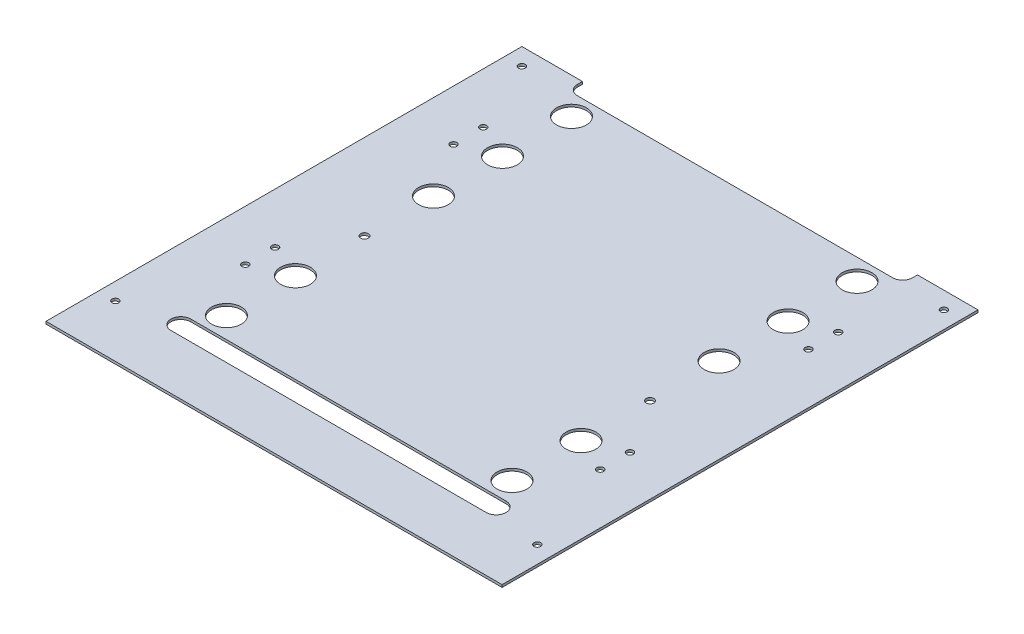
from build123d import *

# Parameters (mm, degrees)
SKETCH1_R           = 2.15265
SKETCH1_R_2         = 9.525
SKETCH1_R_3         = 2.4892
BOSS_EXTRUDE1_DEPTH = 1.5875


with BuildPart() as part:
    # Sketch1 → Boss-Extrude1 (new body)
    with BuildSketch(Plane(origin=(0, 0, 0), x_dir=(1, 0, 0), z_dir=(0, 1, 0))):
        with BuildLine():
            Line((-107.315, 152.4), (-146.05, 152.4))
            Line((-146.05, 152.4), (-146.05, -152.4))
            Line((-146.05, -152.4), (146.05, -152.4))
            Line((146.05, -152.4), (146.05, 152.4))
            Line((146.05, 152.4), (107.315, 152.4))
            Line((107.315, 152.4), (107.315, 149.225))
            ThreePointArc((107.315, 149.225), (105.455128061, 144.734871939), (100.965, 142.875))
            Line((100.965, 142.875), (-100.965, 142.875))
            ThreePointArc((-100.965, 142.875), (-105.455128061, 144.734871939), (-107.315, 149.225))
            Line((-107.315, 149.225), (-107.315, 152.4))
        make_face()
        with Locations(Location((-135.128, -118.872, 0), (0, 0, 270))):
            Circle(SKETCH1_R, mode=Mode.SUBTRACT)
        with Locations(Location((-91.44, -91.44, 0), (0, 0, 270))):
            Circle(SKETCH1_R_2, mode=Mode.SUBTRACT)
        with Locations(Location((-113.665, -57.15, 0), (0, 0, 270))):
            Circle(SKETCH1_R, mode=Mode.SUBTRACT)
        with Locations(Location((-113.665, -38.1, 0), (0, 0, 270))):
            Circle(SKETCH1_R, mode=Mode.SUBTRACT)
        with Locations(Location((-91.44, -47.244, 0), (0, 0, 270))):
            Circle(SKETCH1_R_2, mode=Mode.SUBTRACT)
        with Locations(Location((-91.44, -3.048, 0), (0, 0, 270))):
            Circle(SKETCH1_R_3, mode=Mode.SUBTRACT)
        with BuildLine():
            ThreePointArc((-100.965, -117.475), (-107.315, -111.125), (-100.965, -104.775))
            Line((-100.965, -104.775), (100.965, -104.775))
            ThreePointArc((100.965, -104.775), (107.315, -111.125), (100.965, -117.475))
            Line((100.965, -117.475), (-100.965, -117.475))
        make_face(mode=Mode.SUBTRACT)
        with Locations(Location((135.128, -118.872, 0), (0, 0, 270))):
            Circle(SKETCH1_R, mode=Mode.SUBTRACT)
        with Locations(Location((91.44, -91.44, 0), (0, 0, 270))):
            Circle(SKETCH1_R_2, mode=Mode.SUBTRACT)
        with Locations(Location((91.44, -47.244, 0), (0, 0, 270))):
            Circle(SKETCH1_R_2, mode=Mode.SUBTRACT)
        with Locations(Location((113.665, -57.15, 0), (0, 0, 270))):
            Circle(SKETCH1_R, mode=Mode.SUBTRACT)
        with Locations(Location((113.665, -38.1, 0), (0, 0, 270))):
            Circle(SKETCH1_R, mode=Mode.SUBTRACT)
        with Locations(Location((91.44, -3.048, 0), (0, 0, 270))):
            Circle(SKETCH1_R_3, mode=Mode.SUBTRACT)
        with Locations(Location((-113.665, 76.2, 0), (0, 0, 270))):
            Circle(SKETCH1_R, mode=Mode.SUBTRACT)
        with Locations(Location((-91.44, 41.148, 0), (0, 0, 270))):
            Circle(SKETCH1_R_2, mode=Mode.SUBTRACT)
        with Locations(Location((-113.665, 95.25, 0), (0, 0, 270))):
            Circle(SKETCH1_R, mode=Mode.SUBTRACT)
        with Locations(Location((-91.44, 85.344, 0), (0, 0, 270))):
            Circle(SKETCH1_R_2, mode=Mode.SUBTRACT)
        with Locations(Location((-135.128, 141.478, 0), (0, 0, 270))):
            Circle(SKETCH1_R, mode=Mode.SUBTRACT)
        with Locations(Location((-91.44, 129.54, 0), (0, 0, 270))):
            Circle(SKETCH1_R_2, mode=Mode.SUBTRACT)
        with Locations(Location((91.44, 41.148, 0), (0, 0, 270))):
            Circle(SKETCH1_R_2, mode=Mode.SUBTRACT)
        with Locations(Location((113.665, 76.2, 0), (0, 0, 270))):
            Circle(SKETCH1_R, mode=Mode.SUBTRACT)
        with Locations(Location((91.44, 85.344, 0), (0, 0, 270))):
            Circle(SKETCH1_R_2, mode=Mode.SUBTRACT)
        with Locations(Location((113.665, 95.25, 0), (0, 0, 270))):
            Circle(SKETCH1_R, mode=Mode.SUBTRACT)
        with Locations(Location((91.44, 129.54, 0), (0, 0, 270))):
            Circle(SKETCH1_R_2, mode=Mode.SUBTRACT)
        with Locations(Location((135.128, 141.478, 0), (0, 0, 270))):
            Circle(SKETCH1_R, mode=Mode.SUBTRACT)
    extrude(amount=BOSS_EXTRUDE1_DEPTH)


solid = part.part
